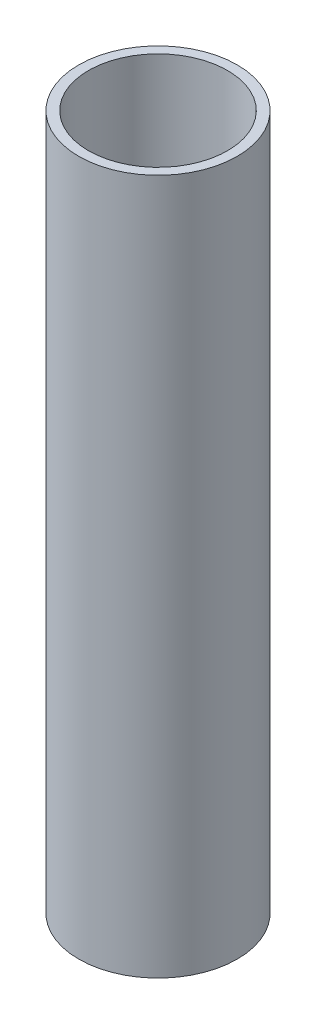
from build123d import *

# Parameters (mm, degrees)
SKETCH1_R           = 14.478
SKETCH1_R_2         = 12.7
BOSS_EXTRUDE1_DEPTH = 127


with BuildPart() as part:
    # Sketch1 → Boss-Extrude1 (new body)
    with BuildSketch(Plane(origin=(0, 0, 0), x_dir=(1, 0, 0), z_dir=(0, 1, 0))):
        with Locations(Location((0, 0, 0), (0, 0, 270))):
            Circle(SKETCH1_R)
        with Locations(Location((0, 0, 0), (0, 0, 270))):
            Circle(SKETCH1_R_2, mode=Mode.SUBTRACT)
    extrude(amount=BOSS_EXTRUDE1_DEPTH)


solid = part.part
